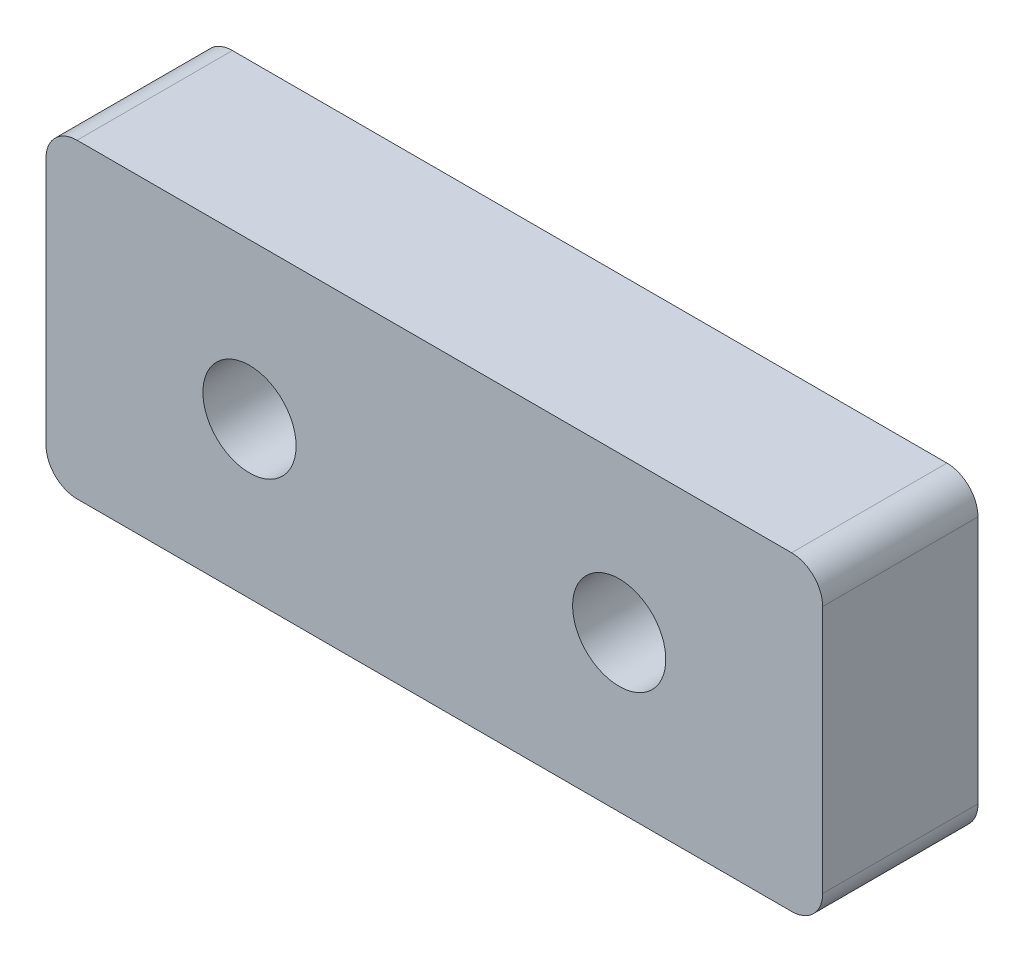
from build123d import *

# Parameters (mm, degrees)
SKETCH_1_W      = 25
SKETCH_1_H      = 10
SKETCH_1_R      = 1.5
EXTRUDE_1_DEPTH = 5
FILLET_1_R      = 1


with BuildPart() as part:
    # 草图1 → 凸台-拉伸1 (new body)
    with BuildSketch(Plane.XY):
        Rectangle(SKETCH_1_W, SKETCH_1_H)
        with Locations((-5.95, 0)):
            Circle(SKETCH_1_R, mode=Mode.SUBTRACT)
        with Locations(Location((5.95, 0, 0), (0, 0, 180))):
            Circle(SKETCH_1_R, mode=Mode.SUBTRACT)
    extrude(amount=EXTRUDE_1_DEPTH)

    # 圆角1
    fillet_1_edges = [part.edges().sort_by_distance(p)[0] for p in [
        (12.5, -5, 2.5),
        (-12.5, -5, 2.5),
        (-12.5, 5, 2.5),
        (12.5, 5, 2.5),
    ]]
    fillet(fillet_1_edges, radius=FILLET_1_R)


solid = part.part
